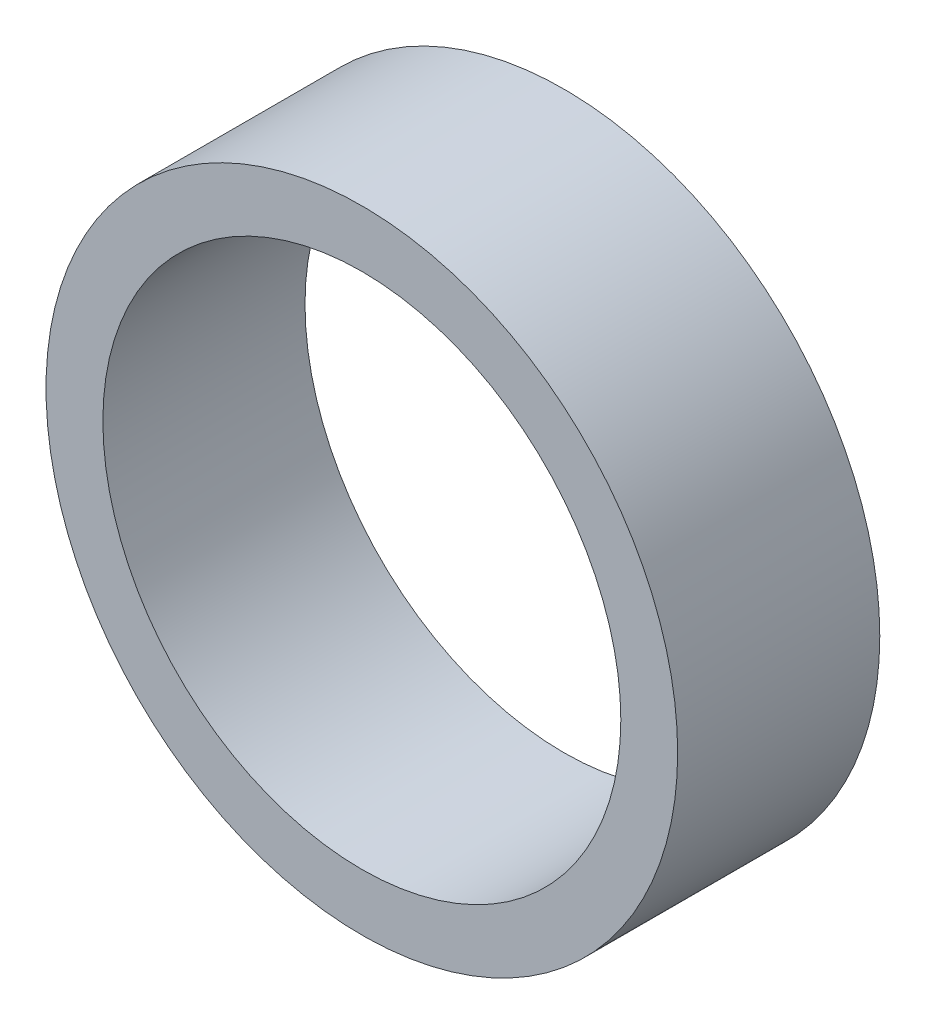
from build123d import *

# Parameters (mm, degrees)
SKETCH_1_R      = 12.5
SKETCH_1_R_2    = 10.25
EXTRUDE_1_DEPTH = 8


with BuildPart() as part:
    # 草图1 → 凸台-拉伸1 (new body)
    with BuildSketch(Plane.XY):
        Circle(SKETCH_1_R)
        Circle(SKETCH_1_R_2, mode=Mode.SUBTRACT)
    extrude(amount=EXTRUDE_1_DEPTH)


solid = part.part
